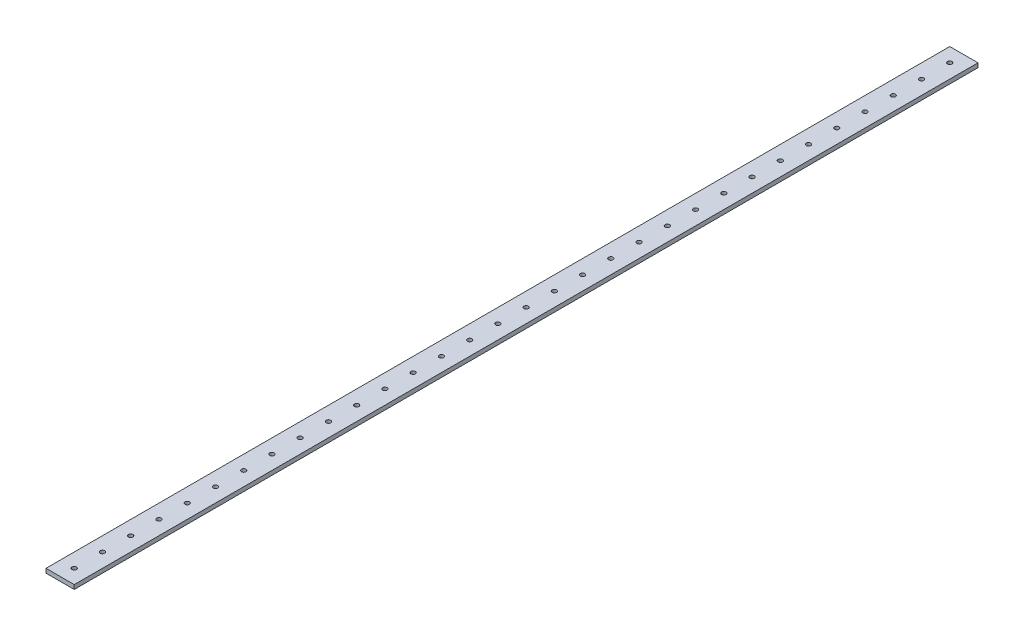
from build123d import *

# Parameters (mm, degrees)
SKETCH_1_W          = 20
SKETCH_1_H          = 3
EXTRUDE_1_DEPTH     = 640
SKETCH_2_R          = 1.575
CUT_EXTRUDE_1_DEPTH = 641.319451524


with BuildPart() as part:
    # 草图1 → 凸台-拉伸1 (new body)
    with BuildSketch(Plane.XY):
        with Locations((10, -1.5)):
            Rectangle(SKETCH_1_W, SKETCH_1_H)
    extrude(amount=EXTRUDE_1_DEPTH)

    # 草图2 → 切除-拉伸1 (cut, through all)
    with BuildSketch(Plane(origin=(0, 0, 0), x_dir=(1, 0, 0), z_dir=(0, 1, 0))):
        with Locations(Location((10, -10, 0), (0, 0, 270))):
            Circle(SKETCH_2_R)
        with Locations(Location((10, -30, 0), (0, 0, 270))):
            Circle(SKETCH_2_R)
        with Locations(Location((10, -50, 0), (0, 0, 270))):
            Circle(SKETCH_2_R)
        with Locations(Location((10, -70, 0), (0, 0, 270))):
            Circle(SKETCH_2_R)
        with Locations(Location((10, -90, 0), (0, 0, 270))):
            Circle(SKETCH_2_R)
        with Locations(Location((10, -110, 0), (0, 0, 270))):
            Circle(SKETCH_2_R)
        with Locations(Location((10, -130, 0), (0, 0, 270))):
            Circle(SKETCH_2_R)
        with Locations(Location((10, -150, 0), (0, 0, 270))):
            Circle(SKETCH_2_R)
        with Locations(Location((10, -170, 0), (0, 0, 270))):
            Circle(SKETCH_2_R)
        with Locations(Location((10, -190, 0), (0, 0, 270))):
            Circle(SKETCH_2_R)
        with Locations(Location((10, -210, 0), (0, 0, 270))):
            Circle(SKETCH_2_R)
        with Locations(Location((10, -230, 0), (0, 0, 270))):
            Circle(SKETCH_2_R)
        with Locations(Location((10, -250, 0), (0, 0, 270))):
            Circle(SKETCH_2_R)
        with Locations(Location((10, -270, 0), (0, 0, 270))):
            Circle(SKETCH_2_R)
        with Locations(Location((10, -290, 0), (0, 0, 270))):
            Circle(SKETCH_2_R)
        with Locations(Location((10, -310, 0), (0, 0, 270))):
            Circle(SKETCH_2_R)
        with Locations(Location((10, -330, 0), (0, 0, 270))):
            Circle(SKETCH_2_R)
        with Locations(Location((10, -350, 0), (0, 0, 270))):
            Circle(SKETCH_2_R)
        with Locations(Location((10, -370, 0), (0, 0, 270))):
            Circle(SKETCH_2_R)
        with Locations(Location((10, -390, 0), (0, 0, 270))):
            Circle(SKETCH_2_R)
        with Locations(Location((10, -410, 0), (0, 0, 270))):
            Circle(SKETCH_2_R)
        with Locations(Location((10, -430, 0), (0, 0, 270))):
            Circle(SKETCH_2_R)
        with Locations(Location((10, -450, 0), (0, 0, 270))):
            Circle(SKETCH_2_R)
        with Locations(Location((10, -470, 0), (0, 0, 270))):
            Circle(SKETCH_2_R)
        with Locations(Location((10, -490, 0), (0, 0, 270))):
            Circle(SKETCH_2_R)
        with Locations(Location((10, -510, 0), (0, 0, 270))):
            Circle(SKETCH_2_R)
        with Locations(Location((10, -530, 0), (0, 0, 270))):
            Circle(SKETCH_2_R)
        with Locations(Location((10, -550, 0), (0, 0, 270))):
            Circle(SKETCH_2_R)
        with Locations(Location((10, -570, 0), (0, 0, 270))):
            Circle(SKETCH_2_R)
        with Locations(Location((10, -590, 0), (0, 0, 270))):
            Circle(SKETCH_2_R)
        with Locations(Location((10, -610, 0), (0, 0, 270))):
            Circle(SKETCH_2_R)
        with Locations(Location((10, -630, 0), (0, 0, 270))):
            Circle(SKETCH_2_R)
    extrude(amount=-CUT_EXTRUDE_1_DEPTH, mode=Mode.SUBTRACT)


solid = part.part
